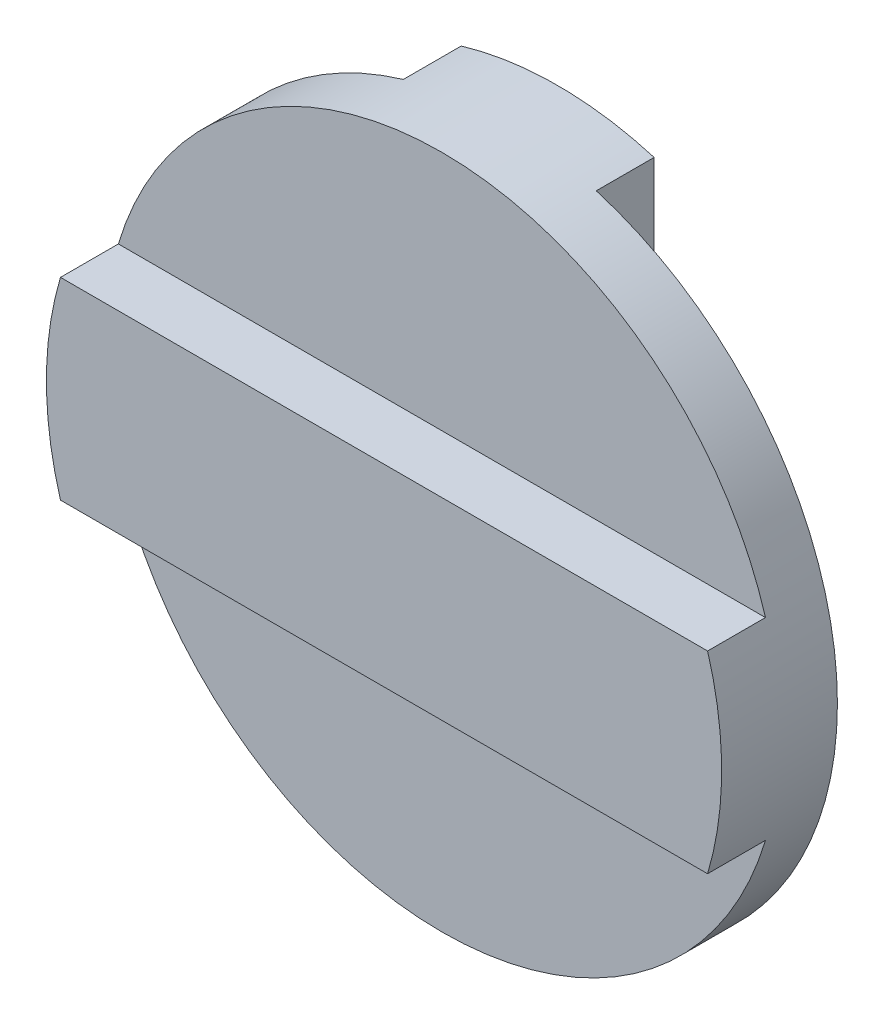
from build123d import *

# Parameters (mm, degrees)
SKETCH1_R           = 17.5
BOSS_EXTRUDE1_DEPTH = 1.5
BOSS_EXTRUDE2_START = 3
BOSS_EXTRUDE2_DEPTH = 3
BOSS_EXTRUDE3_DEPTH = 3


with BuildPart() as part:
    # Sketch1 → Boss-Extrude1 (new, symmetric)
    with BuildSketch(Plane.XY):
        Circle(SKETCH1_R)
    extrude(amount=BOSS_EXTRUDE1_DEPTH, both=True)

    # Sketch2 → Boss-Extrude2 (add)
    with BuildSketch(Plane.XY.offset(1.5).offset(BOSS_EXTRUDE2_START)):
        with BuildLine():
            Line((-16.770509831, -5), (16.770509831, -5))
            ThreePointArc((16.770509831, -5), (17.5, 0), (16.770509831, 5))
            Line((16.770509831, 5), (-16.770509831, 5))
            ThreePointArc((-16.770509831, 5), (-17.5, 0), (-16.770509831, -5))
        make_face()
    extrude(amount=-BOSS_EXTRUDE2_DEPTH)

    # Sketch3 → Boss-Extrude3 (add)
    with BuildSketch(Plane(origin=(0, 0, -1.5), x_dir=(-1, 0, 0), z_dir=(0, 0, -1))):
        with BuildLine():
            Line((-5, 16.770509831), (-5, -16.770509831))
            ThreePointArc((-5, -16.770509831), (0, -17.5), (5, -16.770509831))
            Line((5, -16.770509831), (5, 16.770509831))
            ThreePointArc((5, 16.770509831), (0, 17.5), (-5, 16.770509831))
        make_face()
    extrude(amount=BOSS_EXTRUDE3_DEPTH)


solid = part.part
